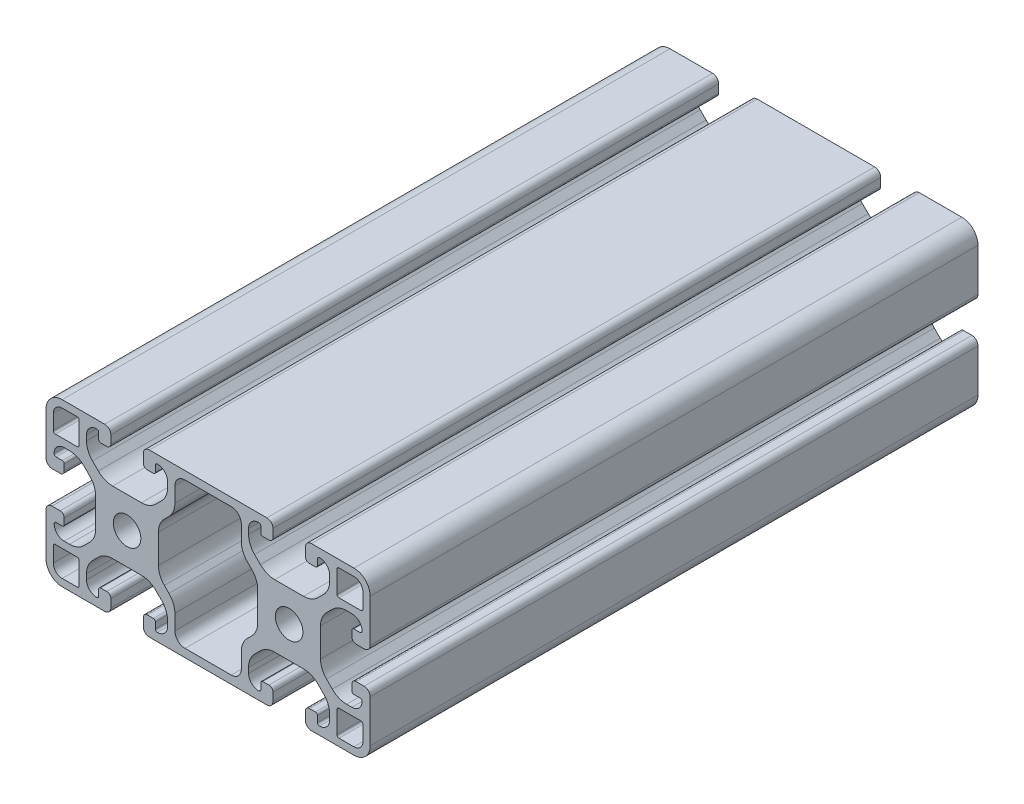
from build123d import *

# Parameters (mm, degrees)
ESQUISSE1_R        = 3.4
BOSS_EXTRU_1_DEPTH = 150


with BuildPart() as part:
    # Esquisse1 → Boss.-Extru.1 (new body)
    with BuildSketch(Plane.XY.offset(20)):
        with BuildLine():
            Line((66.5, 4.5), (65, 4.5))
            ThreePointArc((65, 4.5), (64.292893219, 4.207106781), (64, 3.5))
            Line((64, 3.5), (64, 1.5))
            ThreePointArc((64, 1.5), (64.439339828, 0.439339828), (65.5, 0))
            Line((65.5, 0), (76, 0))
            ThreePointArc((76, 0), (78.828427125, 1.171572875), (80, 4))
            Line((80, 4), (80, 14.5))
            ThreePointArc((80, 14.5), (79.560660172, 15.560660172), (78.5, 16))
            Line((78.5, 16), (76.5, 16))
            ThreePointArc((76.5, 16), (75.792893219, 15.707106781), (75.5, 15))
            Line((75.5, 15), (75.5, 13.5))
            ThreePointArc((75.5, 13.5), (75.646446609, 13.146446609), (76, 13))
            Line((76, 13), (77.5, 13))
            ThreePointArc((77.5, 13), (77.853553391, 12.853553391), (78, 12.5))
            ThreePointArc((78, 12.5), (77.267766953, 10.732233047), (75.5, 10))
            Line((75.5, 10), (74.192388155, 10))
            ThreePointArc((74.192388155, 10), (72.278970994, 10.380602337), (70.656854249, 11.464466094))
            Line((70.656854249, 11.464466094), (69.214466094, 12.906854249))
            ThreePointArc((69.214466094, 12.906854249), (68.130602337, 14.528970994), (67.75, 16.442388155))
            Line((67.75, 16.442388155), (67.75, 23.557611845))
            ThreePointArc((67.75, 23.557611845), (68.130602337, 25.471029006), (69.214466094, 27.093145751))
            Line((69.214466094, 27.093145751), (70.656854249, 28.535533906))
            ThreePointArc((70.656854249, 28.535533906), (72.278970994, 29.619397663), (74.192388155, 30))
            Line((74.192388155, 30), (75.5, 30))
            ThreePointArc((75.5, 30), (77.267766953, 29.267766953), (78, 27.5))
            ThreePointArc((78, 27.5), (77.853553391, 27.146446609), (77.5, 27))
            Line((77.5, 27), (76, 27))
            ThreePointArc((76, 27), (75.646446609, 26.853553391), (75.5, 26.5))
            Line((75.5, 26.5), (75.5, 25))
            ThreePointArc((75.5, 25), (75.792893219, 24.292893219), (76.5, 24))
            Line((76.5, 24), (78.5, 24))
            ThreePointArc((78.5, 24), (79.560660172, 24.439339828), (80, 25.5))
            Line((80, 25.5), (80, 36))
            ThreePointArc((80, 36), (78.828427125, 38.828427125), (76, 40))
            Line((76, 40), (65.5, 40))
            ThreePointArc((65.5, 40), (64.439339828, 39.560660172), (64, 38.5))
            Line((64, 38.5), (64, 36.5))
            ThreePointArc((64, 36.5), (64.292893219, 35.792893219), (65, 35.5))
            Line((65, 35.5), (66.5, 35.5))
            ThreePointArc((66.5, 35.5), (66.853553391, 35.646446609), (67, 36))
            Line((67, 36), (67, 37.5))
            ThreePointArc((67, 37.5), (67.146446609, 37.853553391), (67.5, 38))
            ThreePointArc((67.5, 38), (69.267766953, 37.267766953), (70, 35.5))
            Line((70, 35.5), (70, 34.192388155))
            ThreePointArc((70, 34.192388155), (69.619397663, 32.278970994), (68.535533906, 30.656854249))
            Line((68.535533906, 30.656854249), (67.093145751, 29.214466094))
            ThreePointArc((67.093145751, 29.214466094), (65.471029006, 28.130602337), (63.557611845, 27.75))
            Line((63.557611845, 27.75), (56.442388155, 27.75))
            ThreePointArc((56.442388155, 27.75), (54.528970994, 28.130602337), (52.906854249, 29.214466094))
            Line((52.906854249, 29.214466094), (51.464466094, 30.656854249))
            ThreePointArc((51.464466094, 30.656854249), (50.380602337, 32.278970994), (50, 34.192388155))
            Line((50, 34.192388155), (50, 35.5))
            ThreePointArc((50, 35.5), (50.732233047, 37.267766953), (52.5, 38))
            ThreePointArc((52.5, 38), (52.853553391, 37.853553391), (53, 37.5))
            Line((53, 37.5), (53, 36))
            ThreePointArc((53, 36), (53.146446609, 35.646446609), (53.5, 35.5))
            Line((53.5, 35.5), (55, 35.5))
            ThreePointArc((55, 35.5), (55.707106781, 35.792893219), (56, 36.5))
            Line((56, 36.5), (56, 38.5))
            ThreePointArc((56, 38.5), (55.560660172, 39.560660172), (54.5, 40))
            Line((54.5, 40), (25.5, 40))
            ThreePointArc((25.5, 40), (24.439339828, 39.560660172), (24, 38.5))
            Line((24, 38.5), (24, 36.5))
            ThreePointArc((24, 36.5), (24.292893219, 35.792893219), (25, 35.5))
            Line((25, 35.5), (26.5, 35.5))
            ThreePointArc((26.5, 35.5), (26.853553391, 35.646446609), (27, 36))
            Line((27, 36), (27, 37.5))
            ThreePointArc((27, 37.5), (27.146446609, 37.853553391), (27.5, 38))
            ThreePointArc((27.5, 38), (29.267766953, 37.267766953), (30, 35.5))
            Line((30, 35.5), (30, 34.192388155))
            ThreePointArc((30, 34.192388155), (29.619397663, 32.278970994), (28.535533906, 30.656854249))
            Line((28.535533906, 30.656854249), (27.093145751, 29.214466094))
            ThreePointArc((27.093145751, 29.214466094), (25.471029006, 28.130602337), (23.557611845, 27.75))
            Line((23.557611845, 27.75), (16.442388155, 27.75))
            ThreePointArc((16.442388155, 27.75), (14.528970994, 28.130602337), (12.906854249, 29.214466094))
            Line((12.906854249, 29.214466094), (11.464466094, 30.656854249))
            ThreePointArc((11.464466094, 30.656854249), (10.380602337, 32.278970994), (10, 34.192388155))
            Line((10, 34.192388155), (10, 35.5))
            ThreePointArc((10, 35.5), (10.732233047, 37.267766953), (12.5, 38))
            ThreePointArc((12.5, 38), (12.853553391, 37.853553391), (13, 37.5))
            Line((13, 37.5), (13, 36))
            ThreePointArc((13, 36), (13.146446609, 35.646446609), (13.5, 35.5))
            Line((13.5, 35.5), (15, 35.5))
            ThreePointArc((15, 35.5), (15.707106781, 35.792893219), (16, 36.5))
            Line((16, 36.5), (16, 38.5))
            ThreePointArc((16, 38.5), (15.560660172, 39.560660172), (14.5, 40))
            Line((14.5, 40), (4, 40))
            ThreePointArc((4, 40), (1.171572875, 38.828427125), (0, 36))
            Line((0, 36), (0, 25.5))
            ThreePointArc((0, 25.5), (0.439339828, 24.439339828), (1.5, 24))
            Line((1.5, 24), (3.5, 24))
            ThreePointArc((3.5, 24), (4.207106781, 24.292893219), (4.5, 25))
            Line((4.5, 25), (4.5, 26.5))
            ThreePointArc((4.5, 26.5), (4.353553391, 26.853553391), (4, 27))
            Line((4, 27), (2.5, 27))
            ThreePointArc((2.5, 27), (2.146446609, 27.146446609), (2, 27.5))
            ThreePointArc((2, 27.5), (2.732233047, 29.267766953), (4.5, 30))
            Line((4.5, 30), (5.807611845, 30))
            ThreePointArc((5.807611845, 30), (7.721029006, 29.619397663), (9.343145751, 28.535533906))
            Line((9.343145751, 28.535533906), (10.785533906, 27.093145751))
            ThreePointArc((10.785533906, 27.093145751), (11.869397663, 25.471029006), (12.25, 23.557611845))
            Line((12.25, 23.557611845), (12.25, 16.442388155))
            ThreePointArc((12.25, 16.442388155), (11.869397663, 14.528970994), (10.785533906, 12.906854249))
            Line((10.785533906, 12.906854249), (9.343145751, 11.464466094))
            ThreePointArc((9.343145751, 11.464466094), (7.721029006, 10.380602337), (5.807611845, 10))
            Line((5.807611845, 10), (4.5, 10))
            ThreePointArc((4.5, 10), (2.732233047, 10.732233047), (2, 12.5))
            ThreePointArc((2, 12.5), (2.146446609, 12.853553391), (2.5, 13))
            Line((2.5, 13), (4, 13))
            ThreePointArc((4, 13), (4.353553391, 13.146446609), (4.5, 13.5))
            Line((4.5, 13.5), (4.5, 15))
            ThreePointArc((4.5, 15), (4.207106781, 15.707106781), (3.5, 16))
            Line((3.5, 16), (1.5, 16))
            ThreePointArc((1.5, 16), (0.439339828, 15.560660172), (0, 14.5))
            Line((0, 14.5), (0, 4))
            ThreePointArc((0, 4), (1.171572875, 1.171572875), (4, 0))
            Line((4, 0), (14.5, 0))
            ThreePointArc((14.5, 0), (15.560660172, 0.439339828), (16, 1.5))
            Line((16, 1.5), (16, 3.5))
            ThreePointArc((16, 3.5), (15.707106781, 4.207106781), (15, 4.5))
            Line((15, 4.5), (13.5, 4.5))
            ThreePointArc((13.5, 4.5), (13.146446609, 4.353553391), (13, 4))
            Line((13, 4), (13, 2.5))
            ThreePointArc((13, 2.5), (12.853553391, 2.146446609), (12.5, 2))
            ThreePointArc((12.5, 2), (10.732233047, 2.732233047), (10, 4.5))
            Line((10, 4.5), (10, 5.807611845))
            ThreePointArc((10, 5.807611845), (10.380602337, 7.721029006), (11.464466094, 9.343145751))
            Line((11.464466094, 9.343145751), (12.906854249, 10.785533906))
            ThreePointArc((12.906854249, 10.785533906), (14.528970994, 11.869397663), (16.442388155, 12.25))
            Line((16.442388155, 12.25), (23.557611845, 12.25))
            ThreePointArc((23.557611845, 12.25), (25.471029006, 11.869397663), (27.093145751, 10.785533906))
            Line((27.093145751, 10.785533906), (28.535533906, 9.343145751))
            ThreePointArc((28.535533906, 9.343145751), (29.619397663, 7.721029006), (30, 5.807611845))
            Line((30, 5.807611845), (30, 4.5))
            ThreePointArc((30, 4.5), (29.267766953, 2.732233047), (27.5, 2))
            ThreePointArc((27.5, 2), (27.146446609, 2.146446609), (27, 2.5))
            Line((27, 2.5), (27, 4))
            ThreePointArc((27, 4), (26.853553391, 4.353553391), (26.5, 4.5))
            Line((26.5, 4.5), (25, 4.5))
            ThreePointArc((25, 4.5), (24.292893219, 4.207106781), (24, 3.5))
            Line((24, 3.5), (24, 1.5))
            ThreePointArc((24, 1.5), (24.439339828, 0.439339828), (25.5, 0))
            Line((25.5, 0), (54.5, 0))
            ThreePointArc((54.5, 0), (55.560660172, 0.439339828), (56, 1.5))
            Line((56, 1.5), (56, 3.5))
            ThreePointArc((56, 3.5), (55.707106781, 4.207106781), (55, 4.5))
            Line((55, 4.5), (53.5, 4.5))
            ThreePointArc((53.5, 4.5), (53.146446609, 4.353553391), (53, 4))
            Line((53, 4), (53, 2.5))
            ThreePointArc((53, 2.5), (52.853553391, 2.146446609), (52.5, 2))
            ThreePointArc((52.5, 2), (50.732233047, 2.732233047), (50, 4.5))
            Line((50, 4.5), (50, 5.807611845))
            ThreePointArc((50, 5.807611845), (50.380602337, 7.721029006), (51.464466094, 9.343145751))
            Line((51.464466094, 9.343145751), (52.906854249, 10.785533906))
            ThreePointArc((52.906854249, 10.785533906), (54.528970994, 11.869397663), (56.442388155, 12.25))
            Line((56.442388155, 12.25), (63.557611845, 12.25))
            ThreePointArc((63.557611845, 12.25), (65.471029006, 11.869397663), (67.093145751, 10.785533906))
            Line((67.093145751, 10.785533906), (68.535533906, 9.343145751))
            ThreePointArc((68.535533906, 9.343145751), (69.619397663, 7.721029006), (70, 5.807611845))
            Line((70, 5.807611845), (70, 4.5))
            ThreePointArc((70, 4.5), (69.267766953, 2.732233047), (67.5, 2))
            ThreePointArc((67.5, 2), (67.146446609, 2.146446609), (67, 2.5))
            Line((67, 2.5), (67, 4))
            ThreePointArc((67, 4), (66.853553391, 4.353553391), (66.5, 4.5))
        make_face()
        with Locations(Location((20, 20, 0), (0, 0, 180))):
            Circle(ESQUISSE1_R, mode=Mode.SUBTRACT)
        with Locations(Location((60, 20, 0), (0, 0, 180))):
            Circle(ESQUISSE1_R, mode=Mode.SUBTRACT)
        with BuildLine():
            Line((31.8, 4.5), (31.8, 8.250252532))
            ThreePointArc((31.8, 8.250252532), (31.419397663, 10.163669694), (30.335533906, 11.785786438))
            Line((30.335533906, 11.785786438), (29.214466094, 12.906854249))
            ThreePointArc((29.214466094, 12.906854249), (28.130602337, 14.528970994), (27.75, 16.442388155))
            Line((27.75, 16.442388155), (27.75, 23.557611845))
            ThreePointArc((27.75, 23.557611845), (28.130602337, 25.471029006), (29.214466094, 27.093145751))
            Line((29.214466094, 27.093145751), (30.335533906, 28.214213562))
            ThreePointArc((30.335533906, 28.214213562), (31.419397663, 29.836330306), (31.8, 31.749747468))
            Line((31.8, 31.749747468), (31.8, 35.5))
            ThreePointArc((31.8, 35.5), (32.532233047, 37.267766953), (34.3, 38))
            Line((34.3, 38), (45.7, 38))
            ThreePointArc((45.7, 38), (47.467766953, 37.267766953), (48.2, 35.5))
            Line((48.2, 35.5), (48.2, 31.749747468))
            ThreePointArc((48.2, 31.749747468), (48.580602337, 29.836330306), (49.664466094, 28.214213562))
            Line((49.664466094, 28.214213562), (50.785533906, 27.093145751))
            ThreePointArc((50.785533906, 27.093145751), (51.869397663, 25.471029006), (52.25, 23.557611845))
            Line((52.25, 23.557611845), (52.25, 16.442388155))
            ThreePointArc((52.25, 16.442388155), (51.869397663, 14.528970994), (50.785533906, 12.906854249))
            Line((50.785533906, 12.906854249), (49.664466094, 11.785786438))
            ThreePointArc((49.664466094, 11.785786438), (48.580602337, 10.163669694), (48.2, 8.250252532))
            Line((48.2, 8.250252532), (48.2, 4.5))
            ThreePointArc((48.2, 4.5), (47.467766953, 2.732233047), (45.7, 2))
            Line((45.7, 2), (34.3, 2))
            ThreePointArc((34.3, 2), (32.532233047, 2.732233047), (31.8, 4.5))
        make_face(mode=Mode.SUBTRACT)
        with BuildLine():
            Line((7.7, 1.8), (4, 1.8))
            ThreePointArc((4, 1.8), (2.444365081, 2.444365081), (1.8, 4))
            Line((1.8, 4), (1.8, 7.7))
            ThreePointArc((1.8, 7.7), (1.946446609, 8.053553391), (2.3, 8.2))
            Line((2.3, 8.2), (7.7, 8.2))
            ThreePointArc((7.7, 8.2), (8.053553391, 8.053553391), (8.2, 7.7))
            Line((8.2, 7.7), (8.2, 2.3))
            ThreePointArc((8.2, 2.3), (8.053553391, 1.946446609), (7.7, 1.8))
        make_face(mode=Mode.SUBTRACT)
        with BuildLine():
            Line((72.3, 38.2), (76, 38.2))
            ThreePointArc((76, 38.2), (77.555634919, 37.555634919), (78.2, 36))
            Line((78.2, 36), (78.2, 32.3))
            ThreePointArc((78.2, 32.3), (78.053553391, 31.946446609), (77.7, 31.8))
            Line((77.7, 31.8), (72.3, 31.8))
            ThreePointArc((72.3, 31.8), (71.946446609, 31.946446609), (71.8, 32.3))
            Line((71.8, 32.3), (71.8, 37.7))
            ThreePointArc((71.8, 37.7), (71.946446609, 38.053553391), (72.3, 38.2))
        make_face(mode=Mode.SUBTRACT)
        with BuildLine():
            Line((78.2, 7.7), (78.2, 4))
            ThreePointArc((78.2, 4), (77.555634919, 2.444365081), (76, 1.8))
            Line((76, 1.8), (72.3, 1.8))
            ThreePointArc((72.3, 1.8), (71.946446609, 1.946446609), (71.8, 2.3))
            Line((71.8, 2.3), (71.8, 7.7))
            ThreePointArc((71.8, 7.7), (71.946446609, 8.053553391), (72.3, 8.2))
            Line((72.3, 8.2), (77.7, 8.2))
            ThreePointArc((77.7, 8.2), (78.053553391, 8.053553391), (78.2, 7.7))
        make_face(mode=Mode.SUBTRACT)
        with BuildLine():
            Line((1.8, 32.3), (1.8, 36))
            ThreePointArc((1.8, 36), (2.444365081, 37.555634919), (4, 38.2))
            Line((4, 38.2), (7.7, 38.2))
            ThreePointArc((7.7, 38.2), (8.053553391, 38.053553391), (8.2, 37.7))
            Line((8.2, 37.7), (8.2, 32.3))
            ThreePointArc((8.2, 32.3), (8.053553391, 31.946446609), (7.7, 31.8))
            Line((7.7, 31.8), (2.3, 31.8))
            ThreePointArc((2.3, 31.8), (1.946446609, 31.946446609), (1.8, 32.3))
        make_face(mode=Mode.SUBTRACT)
    extrude(amount=-BOSS_EXTRU_1_DEPTH)


solid = part.part
